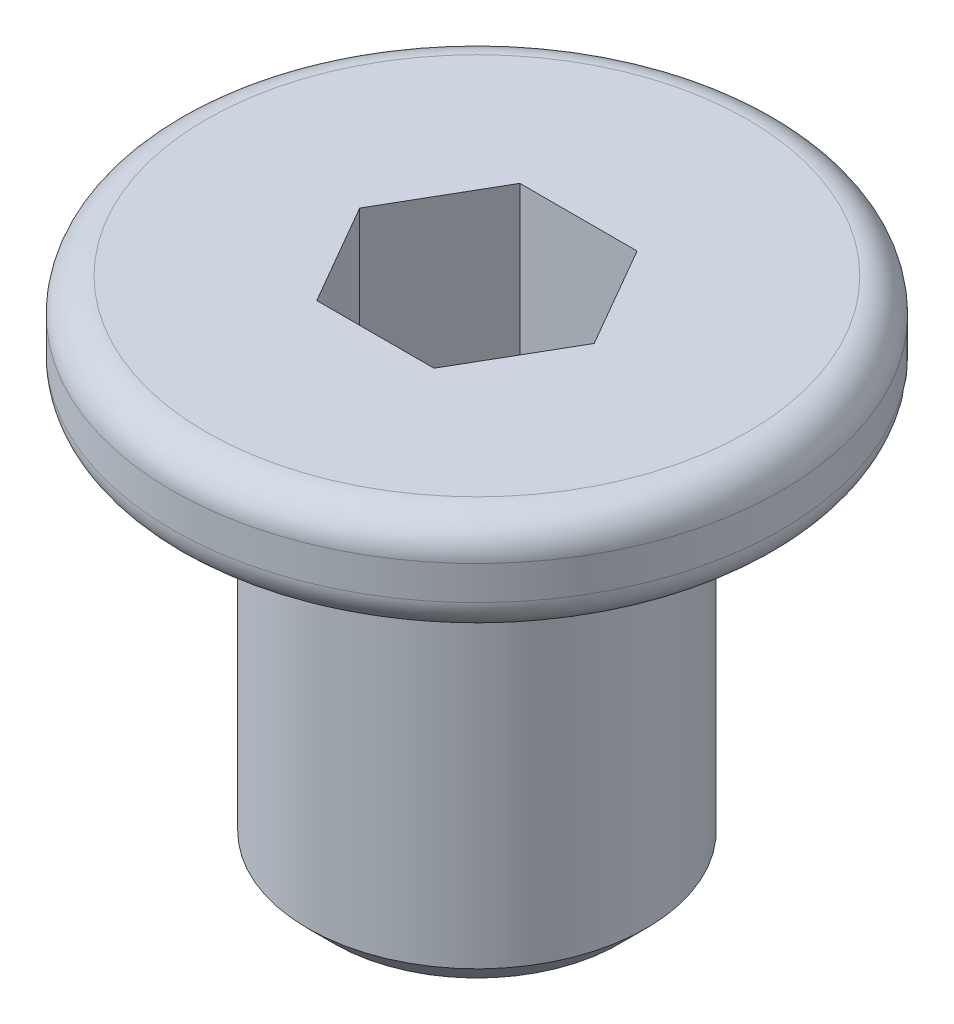
from build123d import *

# Parameters (mm, degrees)
CUT_EXTRUDE2_DEPTH = 3


with BuildPart() as part:
    # Sketch1 → Revolve1 (revolve)
    with BuildSketch(Plane.XY, mode=Mode.PRIVATE) as revolve1_sk:
        with BuildLine():
            Line((-4.5, -0.5), (-4.5, -1))
            ThreePointArc((-4.5, -1), (-4.353553391, -1.353553391), (-4, -1.5))
            Line((-4, -1.5), (-2.5, -1.5))
            Line((-2.5, -1.5), (-2.5, -7.1))
            Line((-2.5, -7.1), (-2.1, -7.5))
            Line((-2.1, -7.5), (0, -7.5))
            Line((0, -7.5), (0, -4))
            Line((0, -4), (-1.5, -3))
            Line((-1.5, -3), (-1.5, 0))
            Line((-1.5, 0), (-4, 0))
            ThreePointArc((-4, 0), (-4.353553391, -0.146446609), (-4.5, -0.5))
        make_face()
    revolve(revolve1_sk.sketch.rotate(Axis((0, 2.75, 0), (0, -1, 0)), 270), axis=Axis((0, 2.75, 0), (0, -1, 0)))

    # Sketch3 → Cut-Extrude2 (cut)
    with BuildSketch(Plane(origin=(0, 0, 0), x_dir=(1, 0, 0), z_dir=(0, 1, 0))):
        Polygon((-0.866025404, -1.5), (0.866025404, -1.5), (1.732050808, 0), (0.866025404, 1.5), (-0.866025404, 1.5), (-1.732050808, 0), align=None)
    extrude(amount=-CUT_EXTRUDE2_DEPTH, mode=Mode.SUBTRACT)


solid = part.part
